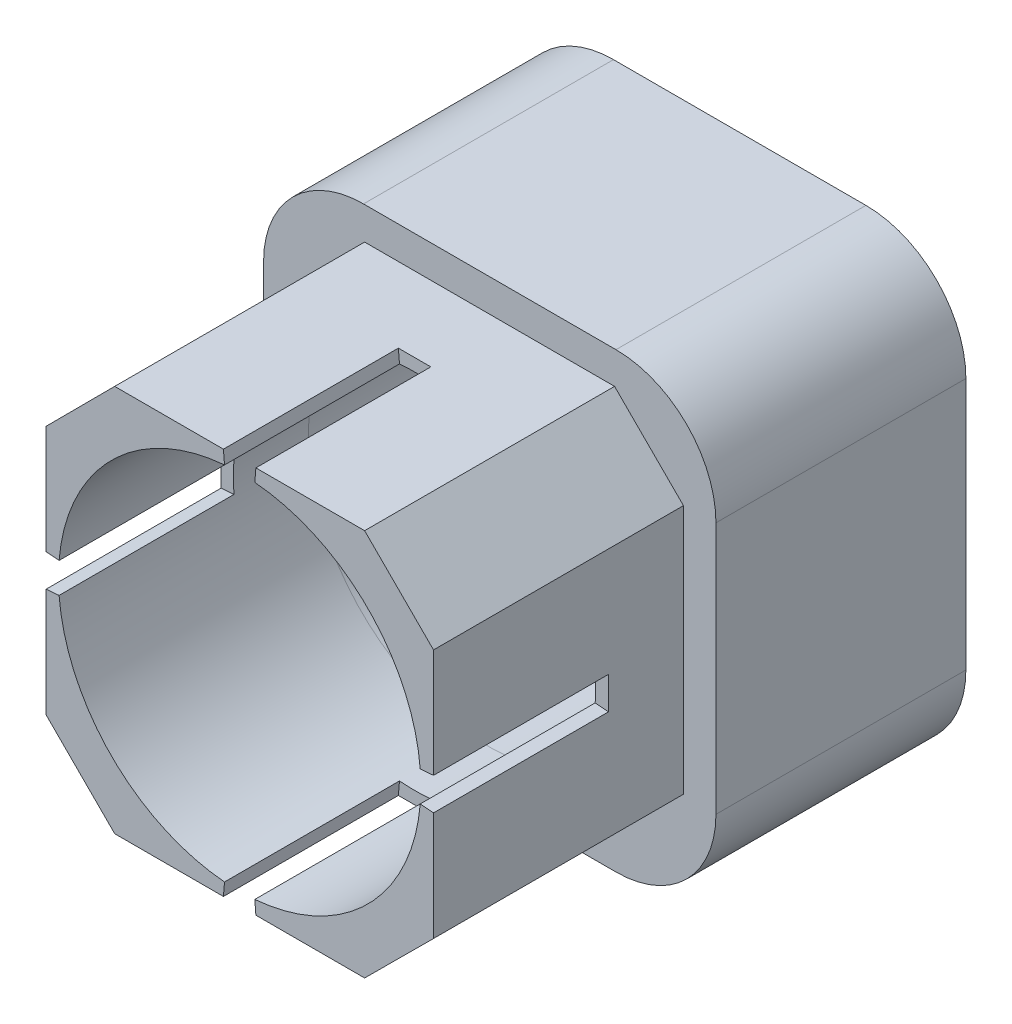
from build123d import *

# Parameters (mm, degrees)
BOSS_EXTRUDE1_DEPTH = 10
SKETCH22_R          = 7.25
BOSS_EXTRUDE4_DEPTH = 10
SKETCH24_R          = 7.256494522
CUT_EXTRUDE15_DEPTH = 35
CUT_EXTRUDE16_DEPTH = 7
CIRPATTERN1_COUNT   = 4


with BuildPart() as part:
    # Sketch1 → Boss-Extrude1 (new body)
    with BuildSketch(Plane.XY):
        with BuildLine():
            Line((-5.05, 9.05), (5.05, 9.05))
            ThreePointArc((5.05, 9.05), (7.878427125, 7.878427125), (9.05, 5.05))
            Line((9.05, 5.05), (9.05, -5.05))
            ThreePointArc((9.05, -5.05), (7.878427125, -7.878427125), (5.05, -9.05))
            Line((5.05, -9.05), (-5.05, -9.05))
            ThreePointArc((-5.05, -9.05), (-7.878427125, -7.878427125), (-9.05, -5.05))
            Line((-9.05, -5.05), (-9.05, 5.05))
            ThreePointArc((-9.05, 5.05), (-7.878427125, 7.878427125), (-5.05, 9.05))
        make_face()
    extrude(amount=BOSS_EXTRUDE1_DEPTH)

    # Sketch22 → Boss-Extrude4 (add)
    with BuildSketch(Plane.XY.offset(10)):
        Polygon((-5.006494522, -7.75), (4.993505478, -7.75), (7.75, -5.003911735), (7.75, 4.996088265), (4.993505478, 7.75), (-5.006494522, 7.75), (-7.75, 4.996088265), (-7.75, -5.003911735), align=None)
        with Locations((-0.006494522, 0)):
            Circle(SKETCH22_R, mode=Mode.SUBTRACT)
    extrude(amount=BOSS_EXTRUDE4_DEPTH)

    # Sketch24 → Cut-Extrude15 (cut)
    with BuildSketch(Plane.XY.offset(10)):
        with Locations(Location((0, 0, 0), (0, 0, 180))):
            Circle(SKETCH24_R)
    extrude(amount=-CUT_EXTRUDE15_DEPTH, mode=Mode.SUBTRACT)

    # Sketch25 → Cut-Extrude16 (cut)
    with BuildSketch(Plane.XY.offset(20)):
        Polygon((0, 0), (7.75, 0.65), (7.75, -0.65), align=None)
    cut_extrude16 = extrude(amount=-CUT_EXTRUDE16_DEPTH, mode=Mode.SUBTRACT)

    # CirPattern1: Cut-Extrude16 ×4 about axis
    cirpattern1_axis = Axis((-0.006494522, 0, 20), (0, 0, -1))
    for i in range(1, CIRPATTERN1_COUNT):
        add(cut_extrude16.rotate(cirpattern1_axis, i * 360 / CIRPATTERN1_COUNT), mode=Mode.SUBTRACT)


solid = part.part
